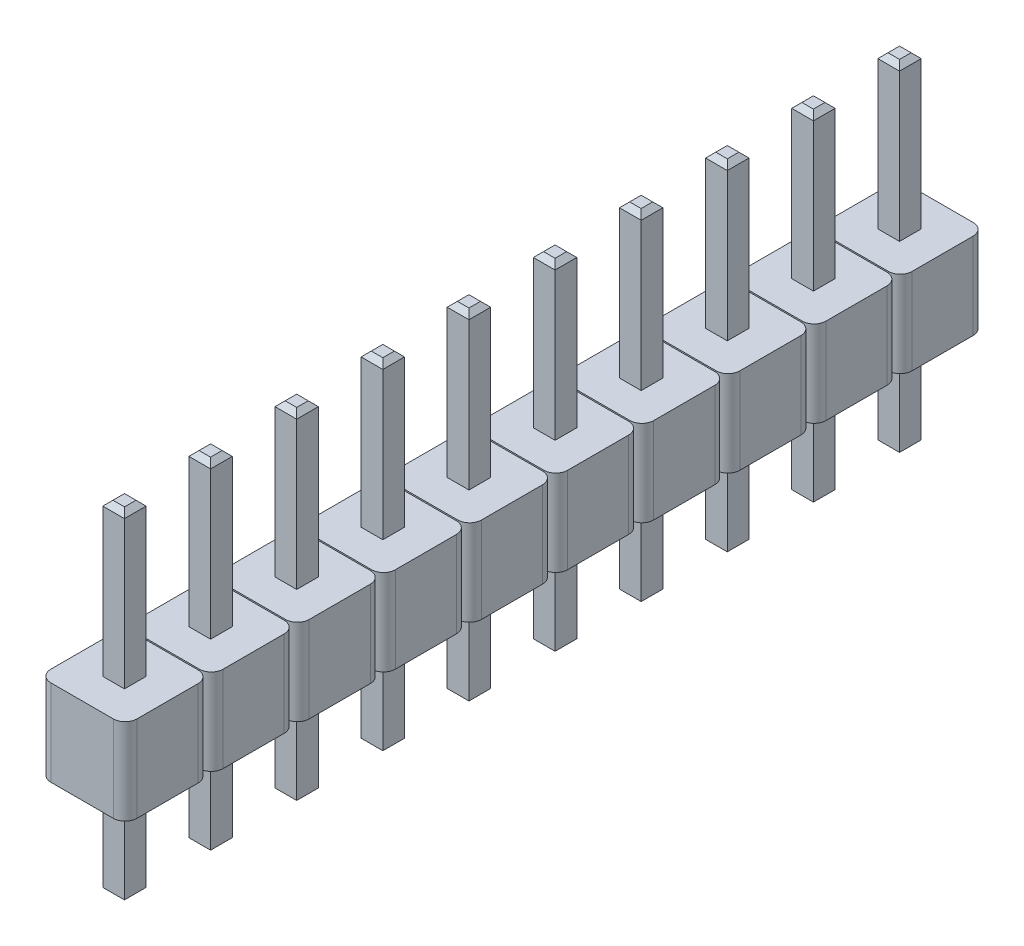
from build123d import *

# Parameters (mm, degrees)
SKETCH1_W           = 0.64
SKETCH1_H           = 0.64
BOSS_EXTRUDE1_DEPTH = 10.04
CHAMFER1_SIZE       = 0.15
BOSS_EXTRUDE2_DEPTH = 2.54
LPATTERN2_COUNT     = 10
LPATTERN2_PITCH     = 2.54


with BuildPart() as part:
    # Sketch1 → Boss-Extrude1 (new body)
    with BuildSketch(Plane(origin=(0, 0, 0), x_dir=(1, 0, 0), z_dir=(0, 1, 0))):
        with Locations((0.32, 0.32)):
            Rectangle(SKETCH1_W, SKETCH1_H)
    extrude(amount=BOSS_EXTRUDE1_DEPTH)

    # Chamfer1
    chamfer1_edges = [part.edges().sort_by_distance(p)[0] for p in [
        (0.32, 0, 0),
        (0.64, 0, -0.32),
        (0.32, 0, -0.64),
        (0, 0, -0.32),
        (0.32, 10.04, -0.64),
        (0.64, 10.04, -0.32),
        (0.32, 10.04, 0),
        (0, 10.04, -0.32),
    ]]
    chamfer(chamfer1_edges, length=CHAMFER1_SIZE)

    # Sketch3 → Boss-Extrude2 (add)
    with BuildSketch(Plane(origin=(0, 5.54, 0), x_dir=(1, 0, 0), z_dir=(0, 1, 0))):
        with BuildLine():
            Line((-0.6, -0.93), (1.24, -0.93))
            ThreePointArc((1.24, -0.93), (1.487487373, -0.827487373), (1.59, -0.58))
            Line((1.59, -0.58), (1.59, 1.22))
            ThreePointArc((1.59, 1.22), (1.487487373, 1.467487373), (1.24, 1.57))
            Line((1.24, 1.57), (-0.6, 1.57))
            ThreePointArc((-0.6, 1.57), (-0.847487373, 1.467487373), (-0.95, 1.22))
            Line((-0.95, 1.22), (-0.95, -0.58))
            ThreePointArc((-0.95, -0.58), (-0.847487373, -0.827487373), (-0.6, -0.93))
        make_face()
    extrude(amount=-BOSS_EXTRUDE2_DEPTH)


with BuildPart() as lpattern2_1:
    # LPattern2: pattern copy
    add(part.part.moved(Location(Vector(0, 0, -1) * (1 * LPATTERN2_PITCH))))


with BuildPart() as lpattern2_2:
    # LPattern2: pattern copy
    add(part.part.moved(Location(Vector(0, 0, -1) * (2 * LPATTERN2_PITCH))))


with BuildPart() as lpattern2_3:
    # LPattern2: pattern copy
    add(part.part.moved(Location(Vector(0, 0, -1) * (3 * LPATTERN2_PITCH))))


with BuildPart() as lpattern2_4:
    # LPattern2: pattern copy
    add(part.part.moved(Location(Vector(0, 0, -1) * (4 * LPATTERN2_PITCH))))


with BuildPart() as lpattern2_5:
    # LPattern2: pattern copy
    add(part.part.moved(Location(Vector(0, 0, -1) * (5 * LPATTERN2_PITCH))))


with BuildPart() as lpattern2_6:
    # LPattern2: pattern copy
    add(part.part.moved(Location(Vector(0, 0, -1) * (6 * LPATTERN2_PITCH))))


with BuildPart() as lpattern2_7:
    # LPattern2: pattern copy
    add(part.part.moved(Location(Vector(0, 0, -1) * (7 * LPATTERN2_PITCH))))


with BuildPart() as lpattern2_8:
    # LPattern2: pattern copy
    add(part.part.moved(Location(Vector(0, 0, -1) * (8 * LPATTERN2_PITCH))))


with BuildPart() as lpattern2_9:
    # LPattern2: pattern copy
    add(part.part.moved(Location(Vector(0, 0, -1) * (9 * LPATTERN2_PITCH))))


solid = Compound([part.part, lpattern2_1.part, lpattern2_2.part, lpattern2_3.part, lpattern2_4.part, lpattern2_5.part, lpattern2_6.part, lpattern2_7.part, lpattern2_8.part, lpattern2_9.part])
